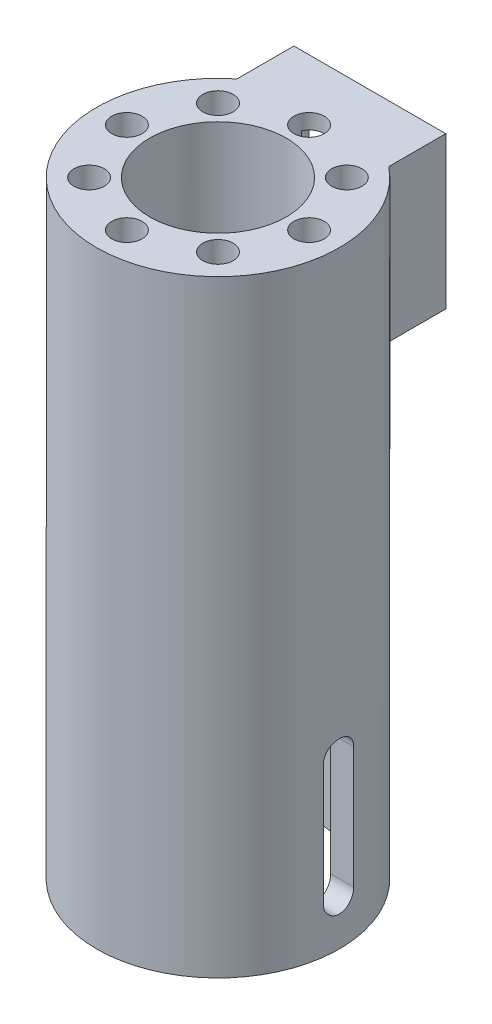
from build123d import *

# Parameters (mm, degrees)
BOSS_EXTRUDE4_DEPTH = 200
CUT_EXTRUDE3_START  = -150
CUT_EXTRUDE3_DEPTH  = 150
SKETCH6_R           = 22.5
CUT_EXTRUDE5_DEPTH  = 120
SKETCH7_R           = 32.5
CUT_EXTRUDE6_DEPTH  = 80
FILLET2_R           = 4
SKETCH8_W           = 40
SKETCH8_H           = 40
CUT_EXTRUDE7_DEPTH  = 18
FILLET3_R           = 5
SKETCH10_W          = 10
SKETCH10_H          = 40
CUT_EXTRUDE9_DEPTH  = 69
SKETCH11_R          = 5
CUT_EXTRUDE10_DEPTH = 10


with BuildPart() as part:
    # Sketch1 → Boss-Extrude4 (new body)
    with BuildSketch(Plane(origin=(0, 0, 0), x_dir=(1, 0, 0), z_dir=(0, 1, 0))):
        with BuildLine():
            Line((0, 50), (-25, 50))
            Line((-25, 50), (-25, 31.224990005))
            ThreePointArc((-25, 31.224990005), (0, -40.00000001), (25, 31.224990005))
            Line((25, 31.224990005), (25, 50))
            Line((25, 50), (0, 50))
        make_face()
    extrude(amount=-BOSS_EXTRUDE4_DEPTH)

    # Sketch5 → Cut-Extrude3 (cut)
    with BuildSketch(Plane.XZ.offset(200).offset(CUT_EXTRUDE3_START)):
        with BuildLine():
            Line((-25, -31.224990005), (-25, -50))
            Line((-25, -50), (25, -50))
            Line((25, -50), (25, -31.224990005))
            ThreePointArc((25, -31.224990005), (0, -40.00000001), (-25, -31.224990005))
        make_face()
    extrude(amount=CUT_EXTRUDE3_DEPTH, mode=Mode.SUBTRACT)

    # Sketch6 → Cut-Extrude5 (cut)
    with BuildSketch(Plane(origin=(0, 0, 0), x_dir=(1, 0, 0), z_dir=(0, 1, 0))):
        with Locations(Location((0, 0, 0), (0, 0, 270))):
            Circle(SKETCH6_R)
    extrude(amount=-CUT_EXTRUDE5_DEPTH, mode=Mode.SUBTRACT)

    # Sketch7 → Cut-Extrude6 (cut)
    with BuildSketch(Plane.XZ.offset(200)):
        with Locations(Location((0, 0, 0), (0, 0, 270))):
            Circle(SKETCH7_R)
    extrude(amount=-CUT_EXTRUDE6_DEPTH, mode=Mode.SUBTRACT)

    # Fillet2
    fillet2_edges = [part.edges().sort_by_distance(p)[0] for p in [
        (0, -120, 32.5),
    ]]
    fillet(fillet2_edges, radius=FILLET2_R)

    # Sketch8 → Cut-Extrude7 (cut)
    with BuildSketch(Plane(origin=(0, 0, -50), x_dir=(-1, 0, 0), z_dir=(0, 0, -1))):
        with Locations((0, -25)):
            Rectangle(SKETCH8_W, SKETCH8_H)
    extrude(amount=-CUT_EXTRUDE7_DEPTH, mode=Mode.SUBTRACT)

    # Fillet3
    fillet3_edges = [part.edges().sort_by_distance(p)[0] for p in [
        (20, -45, -41),
        (20, -5, -41),
        (-20, -5, -41),
        (-20, -45, -41),
    ]]
    fillet(fillet3_edges, radius=FILLET3_R)

    # Sketch10 → Cut-Extrude9 (cut)
    with BuildSketch(Plane(origin=(0, 0, 0), x_dir=(0, 0, -1), z_dir=(1, 0, 0))):
        with Locations((0, -165)):
            Rectangle(SKETCH10_W, SKETCH10_H)
        with BuildLine():
            Line((5, -145), (-5, -145))
            ThreePointArc((-5, -145), (0, -140), (5, -145))
        make_face()
        with BuildLine():
            ThreePointArc((5, -185), (0, -190), (-5, -185))
            Line((-5, -185), (5, -185))
        make_face()
    extrude(amount=CUT_EXTRUDE9_DEPTH, mode=Mode.SUBTRACT)

    # Sketch11 → Cut-Extrude10 (cut)
    with BuildSketch(Plane(origin=(0, 0, 0), x_dir=(1, 0, 0), z_dir=(0, 1, 0))):
        with Locations(Location((30, 0, 0), (0, 0, 270))):
            Circle(SKETCH11_R)
        with Locations(Location((21.213203436, -21.213203436, 0), (0, 0, 270))):
            Circle(SKETCH11_R)
        with Locations(Location((0, -30, 0), (0, 0, 270))):
            Circle(SKETCH11_R)
        with Locations(Location((-21.213203436, -21.213203436, 0), (0, 0, 270))):
            Circle(SKETCH11_R)
        with Locations(Location((-30, 0, 0), (0, 0, 270))):
            Circle(SKETCH11_R)
        with Locations(Location((-21.213203436, 21.213203436, 0), (0, 0, 270))):
            Circle(SKETCH11_R)
        with Locations(Location((0, 30, 0), (0, 0, 270))):
            Circle(SKETCH11_R)
        with Locations(Location((21.213203436, 21.213203436, 0), (0, 0, 270))):
            Circle(SKETCH11_R)
    extrude(amount=-CUT_EXTRUDE10_DEPTH, mode=Mode.SUBTRACT)


solid = part.part
